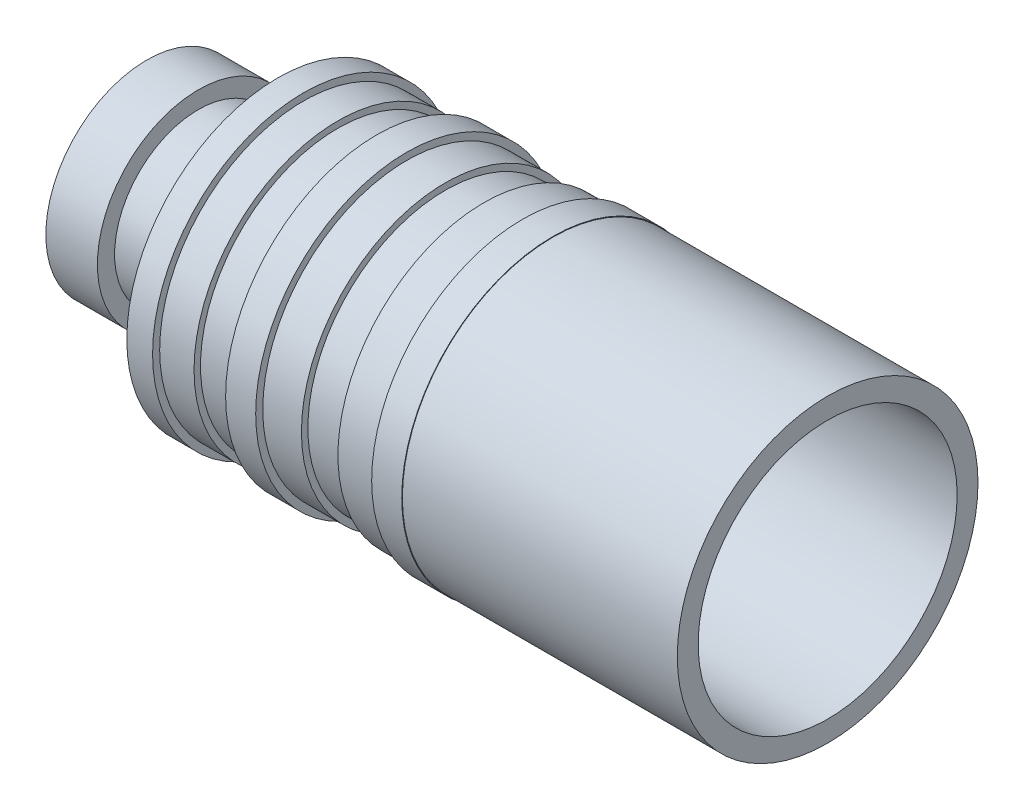
from build123d import *

# Parameters (mm, degrees)
SKETCH1_R            = 15
BOSS_EXTRUDE1_DEPTH  = 5.5
SKETCH2_R            = 23.5
BOSS_EXTRUDE2_DEPTH  = 12
SKETCH4_R            = 19.5
BOSS_EXTRUDE3_DEPTH  = 11.8
SKETCH6_R            = 20.25
BOSS_EXTRUDE4_DEPTH  = 6.7
SKETCH7_R            = 35.15
BOSS_EXTRUDE5_DEPTH  = 6
SKETCH8_R            = 33.5
BOSS_EXTRUDE6_DEPTH  = 8
SKETCH9_R            = 32
BOSS_EXTRUDE7_DEPTH  = 9
SKETCH10_R           = 35.15
BOSS_EXTRUDE8_DEPTH  = 7
SKETCH11_R           = 33.5
BOSS_EXTRUDE9_DEPTH  = 9
SKETCH12_R           = 32
BOSS_EXTRUDE10_DEPTH = 9
SKETCH13_R           = 34
BOSS_EXTRUDE11_DEPTH = 9
SKETCH14_R           = 35.15
BOSS_EXTRUDE12_DEPTH = 7
SKETCH15_R           = 35
BOSS_EXTRUDE13_DEPTH = 64


with BuildPart() as part:
    # Sketch1 → Boss-Extrude1 (new body)
    with BuildSketch(Plane(origin=(0, 0, 0), x_dir=(0, 0, -1), z_dir=(1, 0, 0))):
        Circle(SKETCH1_R)
    extrude(amount=BOSS_EXTRUDE1_DEPTH)

    # Sketch2 → Boss-Extrude2 (add)
    with BuildSketch(Plane(origin=(5.5, 0, 0), x_dir=(0, 0, -1), z_dir=(1, 0, 0))):
        Circle(SKETCH2_R)
    extrude(amount=BOSS_EXTRUDE2_DEPTH)

    # Sketch4 → Boss-Extrude3 (add)
    with BuildSketch(Plane(origin=(17.5, 0, 0), x_dir=(0, 0, -1), z_dir=(1, 0, 0))):
        Circle(SKETCH4_R)
    extrude(amount=BOSS_EXTRUDE3_DEPTH)

    # Sketch6 → Boss-Extrude4 (add)
    with BuildSketch(Plane(origin=(29.3, 0, 0), x_dir=(0, 0, -1), z_dir=(1, 0, 0))):
        Circle(SKETCH6_R)
    extrude(amount=BOSS_EXTRUDE4_DEPTH)

    # Sketch7 → Boss-Extrude5 (add)
    with BuildSketch(Plane(origin=(36, 0, 0), x_dir=(0, 0, -1), z_dir=(1, 0, 0))):
        Circle(SKETCH7_R)
    extrude(amount=BOSS_EXTRUDE5_DEPTH)

    # Sketch8 → Boss-Extrude6 (add)
    with BuildSketch(Plane(origin=(42, 0, 0), x_dir=(0, 0, -1), z_dir=(1, 0, 0))):
        Circle(SKETCH8_R)
    extrude(amount=BOSS_EXTRUDE6_DEPTH)

    # Sketch9 → Boss-Extrude7 (add)
    with BuildSketch(Plane(origin=(50, 0, 0), x_dir=(0, 0, -1), z_dir=(1, 0, 0))):
        Circle(SKETCH9_R)
    extrude(amount=BOSS_EXTRUDE7_DEPTH)

    # Sketch10 → Boss-Extrude8 (add)
    with BuildSketch(Plane(origin=(59, 0, 0), x_dir=(0, 0, -1), z_dir=(1, 0, 0))):
        Circle(SKETCH10_R)
    extrude(amount=BOSS_EXTRUDE8_DEPTH)

    # Sketch11 → Boss-Extrude9 (add)
    with BuildSketch(Plane(origin=(66, 0, 0), x_dir=(0, 0, -1), z_dir=(1, 0, 0))):
        Circle(SKETCH11_R)
    extrude(amount=BOSS_EXTRUDE9_DEPTH)

    # Sketch12 → Boss-Extrude10 (add)
    with BuildSketch(Plane(origin=(75, 0, 0), x_dir=(0, 0, -1), z_dir=(1, 0, 0))):
        Circle(SKETCH12_R)
    extrude(amount=BOSS_EXTRUDE10_DEPTH)

    # Sketch13 → Boss-Extrude11 (add)
    with BuildSketch(Plane(origin=(84, 0, 0), x_dir=(0, 0, -1), z_dir=(1, 0, 0))):
        Circle(SKETCH13_R)
    extrude(amount=BOSS_EXTRUDE11_DEPTH)

    # Sketch14 → Boss-Extrude12 (add)
    with BuildSketch(Plane(origin=(93, 0, 0), x_dir=(0, 0, -1), z_dir=(1, 0, 0))):
        Circle(SKETCH14_R)
    extrude(amount=BOSS_EXTRUDE12_DEPTH)

    # Sketch15 → Boss-Extrude13 (add)
    with BuildSketch(Plane(origin=(100, 0, 0), x_dir=(0, 0, -1), z_dir=(1, 0, 0))):
        Circle(SKETCH15_R)
    extrude(amount=BOSS_EXTRUDE13_DEPTH)

    # Sketch16 → Cut-Revolve1 (revolve, cut)
    with BuildSketch(Plane(origin=(0, 0, 0), x_dir=(1, 0, 0), z_dir=(0, 1, 0))):
        with BuildLine():
            Line((164, 30.145778452), (104.875699315, 30.145778452))
            add(Edge.make_bspline(
                [(104.875699315, 30.145778452), (111.575177395, 21.323772465), (113.598201805, 11.115911288), (113.598201805, 0)],
                knots=[0, 0, 0, 0, 1, 1, 1, 1], degree=3))
            Line((113.598201805, 0), (164, 0))
            Line((164, 0), (164, 30.145778452))
        make_face()
    revolve(axis=Axis((164, 0, 0), (-1, 0, 0)), mode=Mode.SUBTRACT)


solid = part.part
